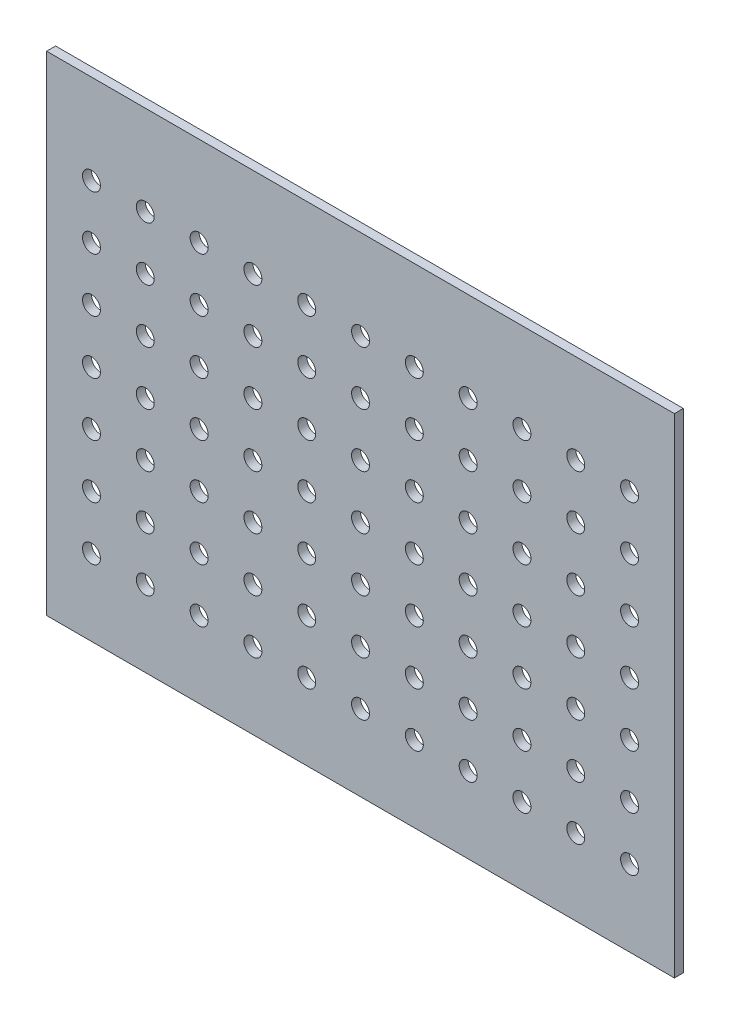
from build123d import *

# Parameters (mm, degrees)
CROQUIS1_W              = 700
CROQUIS1_H              = 545
SALIENTE_EXTRUIR1_DEPTH = 10
CROQUIS2_R              = 10
CORTAR_EXTRUIR1_DEPTH   = 454.305195289
MATRIZL1_COUNT          = 11
MATRIZL1_PITCH          = 60
MATRIZL1_COUNT_DIR2     = 7
MATRIZL1_PITCH_DIR2     = 60


with BuildPart() as part:
    # Croquis1 → Saliente-Extruir1 (new body)
    with BuildSketch(Plane.XY):
        with Locations((-7.800687285, -5.644329897)):
            Rectangle(CROQUIS1_W, CROQUIS1_H)
    extrude(amount=SALIENTE_EXTRUIR1_DEPTH)

    # Croquis2 → Cortar-Extruir1 (cut, through all)
    with BuildSketch(Plane.XY.offset(10)):
        with Locations((-307.800687285, 166.855670103)):
            Circle(CROQUIS2_R)
    cortar_extruir1 = extrude(amount=-CORTAR_EXTRUIR1_DEPTH, mode=Mode.SUBTRACT)

    # MatrizL1: Cortar-Extruir1 11 × 7
    with Locations(*[(i * MATRIZL1_PITCH, -j * MATRIZL1_PITCH_DIR2, 0) for i in range(MATRIZL1_COUNT) for j in range(MATRIZL1_COUNT_DIR2) if (i, j) != (0, 0)]):
        add(cortar_extruir1, mode=Mode.SUBTRACT)


solid = part.part
